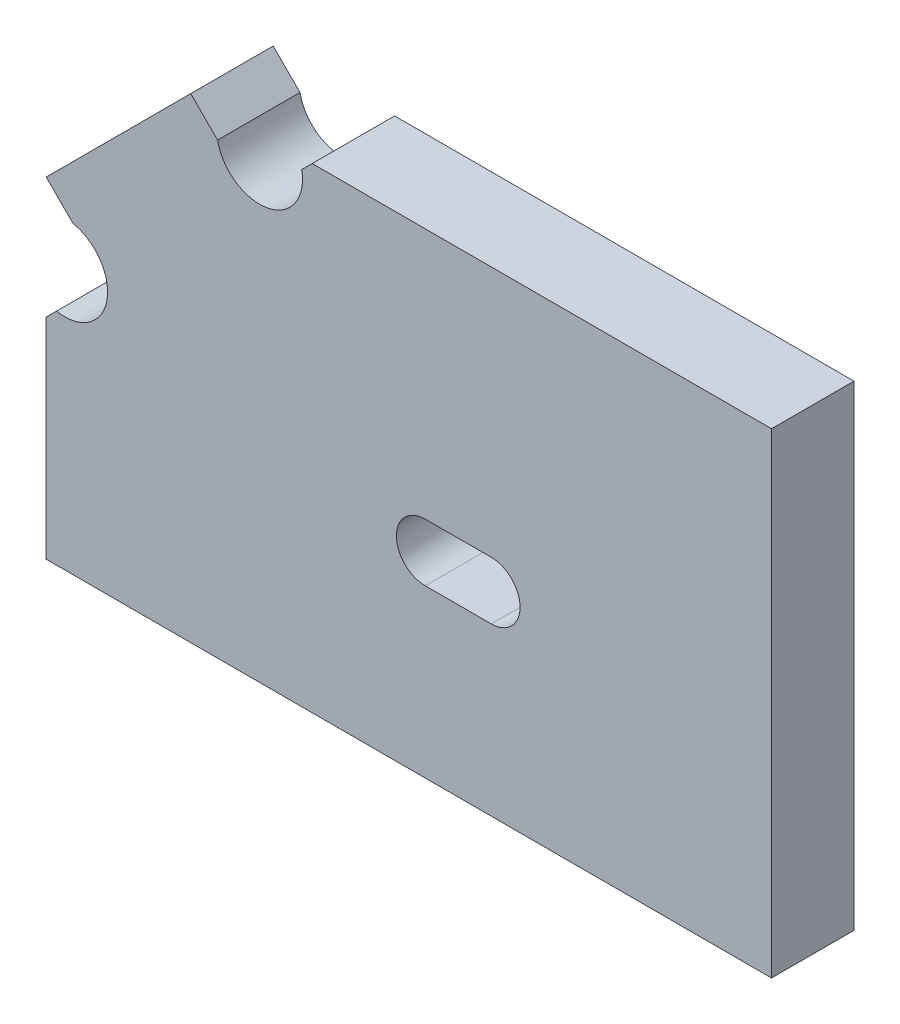
from build123d import *

# Parameters (mm, degrees)
BOSS_EXTRUDE1_DEPTH = 12.7
CUT_EXTRUDE1_DEPTH  = 82.028788994


with BuildPart() as part:
    # Sketch1 → Boss-Extrude1 (new body)
    with BuildSketch(Plane.XY):
        with BuildLine():
            Line((-0.830126662, 34.37418152), (69.93418152, 34.37418152))
            Line((69.93418152, 34.37418152), (69.93418152, -38.90481848))
            Line((69.93418152, -38.90481848), (-41.82581848, -38.90481848))
            Line((-41.82581848, -38.90481848), (-41.82581848, -6.621510298))
            Line((-41.82581848, -6.621510298), (-40.215693332, -5.01138515))
            ThreePointArc((-40.215693332, -5.01138515), (-32.463490161, 0.197163401), (-37.672038711, 7.949366571))
            Line((-37.672038711, 7.949366571), (-41.802956527, 12.080284387))
            Line((-41.802956527, 12.080284387), (-19.531921346, 34.351319567))
            Line((-19.531921346, 34.351319567), (-15.401003531, 30.220401752))
            ThreePointArc((-15.401003531, 30.220401752), (-7.64880036, 25.011853201), (-2.44025181, 32.764056372))
            Line((-2.44025181, 32.764056372), (-0.830126662, 34.37418152))
        make_face()
    extrude(amount=BOSS_EXTRUDE1_DEPTH)

    # Sketch2 → Cut-Extrude1 (cut, through all)
    with BuildSketch(Plane(origin=(0, 0, 0), x_dir=(-1, 0, 0), z_dir=(0, 0, -1))):
        with BuildLine():
            Line((-26.75418152, -4.36081848), (-16.59418152, -4.36081848))
            ThreePointArc((-16.59418152, -4.36081848), (-12.14918152, -8.80581848), (-16.59418152, -13.25081848))
            Line((-16.59418152, -13.25081848), (-26.75418152, -13.25081848))
            ThreePointArc((-26.75418152, -13.25081848), (-31.19918152, -8.80581848), (-26.75418152, -4.36081848))
        make_face()
    extrude(amount=-CUT_EXTRUDE1_DEPTH, mode=Mode.SUBTRACT)


solid = part.part
